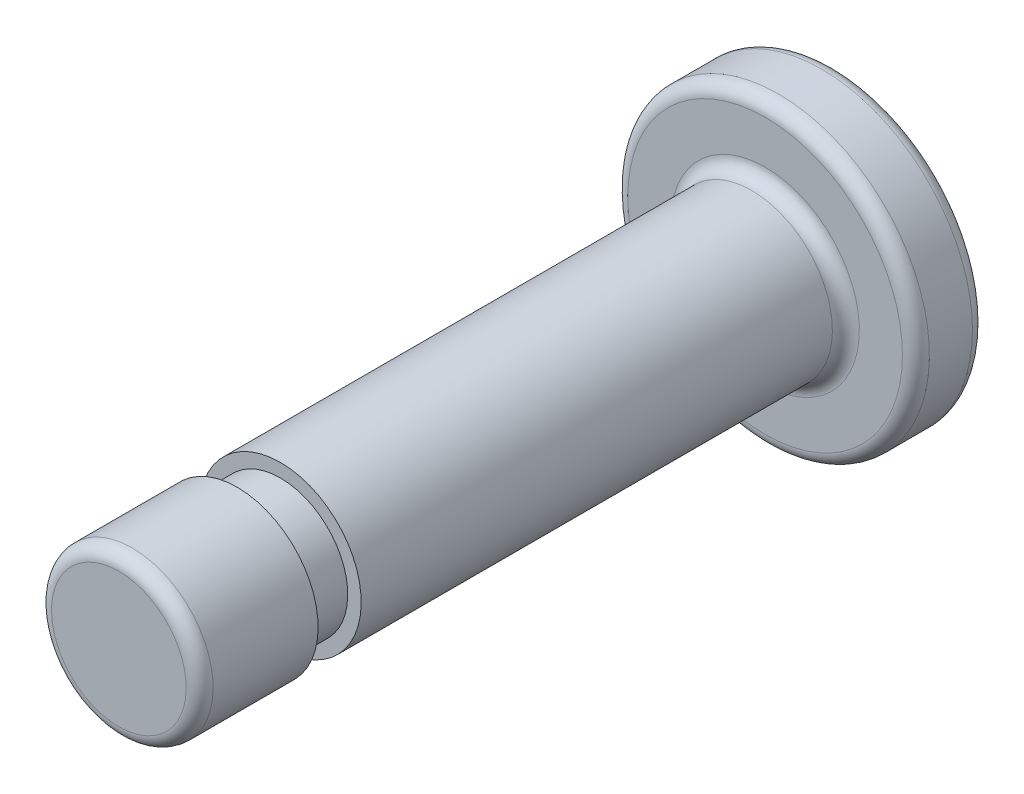
from build123d import *

# Parameters (mm, degrees)
FILLET_1_R = 0.25


with BuildPart() as part:
    # 草图1 → 旋转1 (revolve)
    with BuildSketch(Plane.YZ, mode=Mode.PRIVATE) as revolve_1_sk:
        Polygon((0, 0), (-1.5, 0), (-1.5, -2.2), (-1.25, -2.2), (-1.25, -3), (-1.5, -3), (-1.5, -12), (-2.8, -12), (-2.8, -13.3), (0, -13.3), align=None)
    revolve(revolve_1_sk.sketch.rotate(Axis((0, 0, -13.3), (0, 0, 1)), 180), axis=Axis((0, 0, -13.3), (0, 0, 1)))

    # 圆角1
    fillet_1_edges = [part.edges().sort_by_distance(p)[0] for p in [
        (0, -1.5, 0),
        (0, -2.8, -13.3),
        (0, -2.8, -12),
        (0, -1.5, -12),
    ]]
    fillet(fillet_1_edges, radius=FILLET_1_R)


solid = part.part
